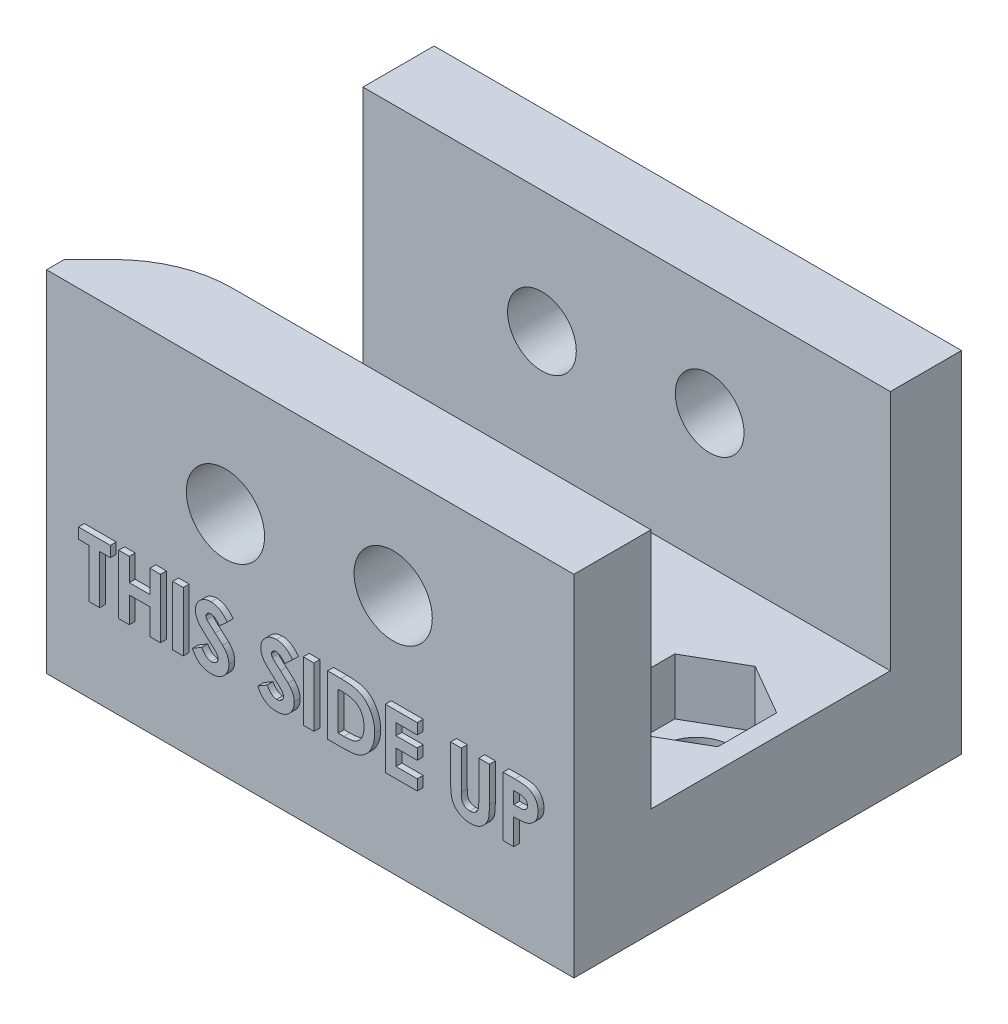
from build123d import *

# Parameters (mm, degrees)
SKETCH1_W                      = 44.5
SKETCH1_H                      = 20
BOSS_EXTRUDE1_DEPTH            = 6
SKETCH2_W                      = 44.5
SKETCH2_H                      = 9.5
BOSS_EXTRUDE2_DEPTH            = 6
SKETCH2_3_W                    = 44.5
SKETCH2_3_H                    = 9.1
BOSS_EXTRUDE3_DEPTH            = 20.2
BOSS_EXTRUDE4_DEPTH            = 6.5
SKETCH4_R                      = 2.9
CUT_EXTRUDE1_DEPTH             = 54.146989567
CUT_EXTRUDE2_DEPTH             = 4.75
SKETCH6_W                      = 18.5
SKETCH6_H                      = 30.7
CUT_EXTRUDE3_DEPTH             = 0.5
CHAMFER1_SIZE                  = 5
BOSS_EXTRUDE5_DEPTH            = 0.5
SKETCH11_W                     = 0.897435897
SKETCH11_H                     = 5
SKETCH11_W_2                   = 0.897435898
BOSS_EXTRUDE9_DEPTH            = 0.5
M5_CLEARANCE_HOLE1_D           = 5.8
M5_CLEARANCE_HOLE1_DEPTH       = 6
CUT_EXTRUDE4_REACH             = 50.658
SKETCH15_R                     = 3.3
CUT_EXTRUDE4_DIRECTION_2_DEPTH = 49.65750216
FILLET1_R                      = 10


with BuildPart() as part:
    # Sketch1 → Boss-Extrude1 (new body)
    with BuildSketch(Plane.XY):
        with Locations((7.5, 0)):
            Rectangle(SKETCH1_W, SKETCH1_H)
    extrude(amount=BOSS_EXTRUDE1_DEPTH)

    # Sketch2 → Boss-Extrude2 (add)
    with BuildSketch(Plane.XY.offset(6)):
        with Locations((7.5, -14.75)):
            Rectangle(SKETCH2_W, SKETCH2_H)
    extrude(amount=-BOSS_EXTRUDE2_DEPTH)

    # Sketch2<3> → Boss-Extrude3 (add)
    with BuildSketch(Plane.XY.offset(6)):
        with Locations((7.5, -14.95)):
            Rectangle(SKETCH2_3_W, SKETCH2_3_H)
    extrude(amount=BOSS_EXTRUDE3_DEPTH)

    # Sketch3 → Boss-Extrude4 (add)
    with BuildSketch(Plane.XY.offset(26.2)):
        Polygon((-14.75, 10), (-14.75, -10.4), (-14.75, -19.5), (29.75, -19.5), (29.75, -10.4), (29.75, 10), align=None)
    extrude(amount=BOSS_EXTRUDE4_DEPTH)

    # Sketch4 → Cut-Extrude1 (cut, through all)
    with BuildSketch(Plane.XZ.offset(19.5)):
        with Locations(Location((-8.725, 16.35, 0), (0, 0, 270))):
            Circle(SKETCH4_R)
        with Locations(Location((23.725, 16.35, 0), (0, 0, 90))):
            Circle(SKETCH4_R)
    extrude(amount=-CUT_EXTRUDE1_DEPTH, mode=Mode.SUBTRACT)

    # Sketch5 → Cut-Extrude2 (cut)
    with BuildSketch(Plane(origin=(0, -10.4, 0), x_dir=(1, 0, 0), z_dir=(0, 1, 0))):
        Polygon((-8.725, -11.384787685), (-13.025, -13.867393842), (-13.025, -18.832606158), (-8.725, -21.315212315), (-4.425, -18.832606158), (-4.425, -13.867393842), align=None)
        Polygon((23.725, -11.384787685), (19.425, -13.867393842), (19.425, -18.832606158), (23.725, -21.315212315), (28.025, -18.832606158), (28.025, -13.867393842), align=None)
    extrude(amount=-CUT_EXTRUDE2_DEPTH, mode=Mode.SUBTRACT)

    # Sketch6 → Cut-Extrude3 (cut)
    with BuildSketch(Plane.XZ.offset(19.5)):
        with Locations((7.5, 16.35)):
            Rectangle(SKETCH6_W, SKETCH6_H)
    extrude(amount=-CUT_EXTRUDE3_DEPTH, mode=Mode.SUBTRACT)

    # Chamfer1
    chamfer1_edges = [part.edges().sort_by_distance(p)[0] for p in [
        (-14.75, -0.2, 26.2),
    ]]
    chamfer(chamfer1_edges, length=CHAMFER1_SIZE)

    # Sketch8 → Boss-Extrude5 (add)
    # profile 1 of 8: a face of its own
    with BuildSketch(Plane(origin=(0, 0, 0), x_dir=(-1, 0, 0), z_dir=(0, 0, -1))):
        with BuildLine():
            Line((-22.928204882, -13.229726055), (-22.928204882, -7.729726055))
            Line((-22.928204882, -7.729726055), (-22.046794625, -7.729726055))
            add(Edge.make_bspline(
                [(-22.046794625, -7.729726055), (-21.985090396, -7.729719013), (-21.865693882, -7.729705387), (-21.693435873, -7.735754523), (-21.533681117, -7.743579758), (-21.386938015, -7.752334376), (-21.252956802, -7.767420332), (-21.131941217, -7.783319282), (-21.02364947, -7.802492435), (-20.956698568, -7.819691348), (-20.925200074, -7.827782946)],
                knots=[0, 0, 0, 0, 1.311965854, 2.538629056, 3.664479157, 4.713267157, 5.663616078, 6.530575999, 7.308677837, 8, 8, 8, 8], degree=3))
            add(Edge.make_bspline(
                [(-20.925200074, -7.827782946), (-20.883839354, -7.839196291), (-20.802676342, -7.861592936), (-20.686425009, -7.906823929), (-20.576144403, -7.957101385), (-20.471969175, -8.014458559), (-20.374539001, -8.079587913), (-20.284224149, -8.153006332), (-20.199076752, -8.231766805), (-20.122120199, -8.318064364), (-20.052564154, -8.409253721), (-19.992132423, -8.505310981), (-19.939624993, -8.604767367), (-19.897605296, -8.708874471), (-19.865944244, -8.817152851), (-19.842787483, -8.929140143), (-19.827778765, -9.045190701), (-19.826360639, -9.124143688), (-19.825640779, -9.164221248)],
                knots=[0, 0, 0, 0, 1.099996261, 2.158545794, 3.195537121, 4.207578794, 5.205712374, 6.197378256, 7.190519799, 8.17788031, 9.159561366, 10.129234751, 11.085776129, 12.040971148, 13.00380137, 13.975669004, 14.972423361, 16, 16, 16, 16], degree=3))
            add(Edge.make_bspline(
                [(-19.825640779, -9.164221248), (-19.827522998, -9.215710392), (-19.831227915, -9.317060446), (-19.854895176, -9.465925338), (-19.899274977, -9.606624059), (-19.957344868, -9.741749631), (-20.036301765, -9.870798037), (-20.136561753, -9.993707916), (-20.25650095, -10.114263848), (-20.348500935, -10.186528997), (-20.39635392, -10.224117081)],
                knots=[0, 0, 0, 0, 0.986156485, 1.941127874, 2.875419072, 3.804401753, 4.751181392, 5.761612777, 6.835722519, 8, 8, 8, 8], degree=3))
            add(Edge.make_bspline(
                [(-20.39635392, -10.224117081), (-20.357576157, -10.243912793), (-20.281543691, -10.282726707), (-20.173599926, -10.346525196), (-20.073655784, -10.41438298), (-19.981263143, -10.484934734), (-19.898360047, -10.561171248), (-19.821523285, -10.63869967), (-19.754543587, -10.721962055), (-19.694648322, -10.807990775), (-19.642588331, -10.898031535), (-19.597249819, -10.991932277), (-19.558954005, -11.090013785), (-19.526524119, -11.191776904), (-19.502337901, -11.297571652), (-19.486567973, -11.407435865), (-19.47449353, -11.520994851), (-19.473554252, -11.598348396), (-19.473076676, -11.63767878)],
                knots=[0, 0, 0, 0, 1.164658916, 2.283573913, 3.35186032, 4.395461096, 5.390182219, 6.362969632, 7.312859996, 8.245001507, 9.165155236, 10.092416118, 11.032087915, 11.979892451, 12.947605196, 13.931445124, 14.948243989, 16, 16, 16, 16], degree=3))
            add(Edge.make_bspline(
                [(-19.473076676, -11.63767878), (-19.476175823, -11.712797563), (-19.482291977, -11.861044181), (-19.52701031, -12.078704263), (-19.604537689, -12.285065763), (-19.708640974, -12.479308511), (-19.83691625, -12.6558095), (-19.984396032, -12.810422833), (-20.149595537, -12.941299587), (-20.302012047, -13.029631243), (-20.433840326, -13.088910044), (-20.543031226, -13.125559937), (-20.660299938, -13.159512343), (-20.787794544, -13.183354423), (-20.92320374, -13.205177317), (-21.067847773, -13.218651223), (-21.221456308, -13.227782158), (-21.32696129, -13.229064989), (-21.381329882, -13.229726055)],
                knots=[0, 0, 0, 0, 1.284142165, 2.534249414, 3.780121997, 5.041676246, 6.291546858, 7.49970053, 8.684500223, 9.883330709, 10.50184324, 11.153274765, 11.851151195, 12.587658647, 13.369265475, 14.195992086, 15.070362669, 16, 16, 16, 16], degree=3))
            Line((-21.381329882, -13.229726055), (-22.928204882, -13.229726055))
        make_face()
        with BuildLine():
            Line((-21.941025394, -8.716905543), (-21.941025394, -9.915623491))
            Line((-21.941025394, -9.915623491), (-21.678805843, -9.915623491))
            add(Edge.make_bspline(
                [(-21.678805843, -9.915623491), (-21.64316785, -9.915312715), (-21.574370862, -9.914712779), (-21.475000909, -9.906985814), (-21.382602901, -9.893803133), (-21.297527283, -9.875409977), (-21.218981544, -9.852053349), (-21.147467458, -9.823950297), (-21.08329946, -9.789661518), (-21.008751086, -9.738586869), (-20.92994808, -9.663428237), (-20.860578679, -9.55484602), (-20.819720566, -9.429976884), (-20.815170074, -9.3419095), (-20.812820266, -9.296432786)],
                knots=[0, 0, 0, 0, 1.065314748, 2.056525647, 2.977365736, 3.853934255, 4.656397591, 5.425096493, 6.14721249, 6.826394842, 8.123232004, 9.372140726, 10.643011755, 12, 12, 12, 12], degree=3))
            add(Edge.make_bspline(
                [(-20.812820266, -9.296432786), (-20.814700543, -9.253836288), (-20.818335981, -9.17147767), (-20.859474848, -9.055838835), (-20.923371642, -8.953359161), (-20.998810788, -8.883220205), (-21.069851403, -8.835317366), (-21.130680737, -8.803775386), (-21.197445499, -8.775539328), (-21.271438183, -8.75394935), (-21.35223625, -8.737748991), (-21.439447219, -8.725851767), (-21.533221559, -8.71775401), (-21.597991695, -8.717194432), (-21.631430042, -8.716905543)],
                knots=[0, 0, 0, 0, 1.347982417, 2.606269829, 3.849316587, 5.153353503, 5.842674298, 6.568177932, 7.326619318, 8.142485038, 9.012069166, 9.942760135, 10.937925643, 12, 12, 12, 12], degree=3))
            Line((-21.631430042, -8.716905543), (-21.941025394, -8.716905543))
        make_face(mode=Mode.SUBTRACT)
        with BuildLine():
            Line((-21.941025394, -10.832290158), (-21.941025394, -12.242546568))
            Line((-21.941025394, -12.242546568), (-21.656770587, -12.242546568))
            add(Edge.make_bspline(
                [(-21.656770587, -12.242546568), (-21.600573049, -12.242225514), (-21.492526271, -12.241608247), (-21.337749453, -12.234150191), (-21.197018631, -12.220708359), (-21.070706688, -12.203927314), (-20.958620155, -12.181191624), (-20.861137911, -12.152286108), (-20.776923112, -12.120485005), (-20.706480715, -12.081206867), (-20.648933312, -12.035496855), (-20.597002815, -11.988780125), (-20.554661923, -11.934887963), (-20.52116102, -11.87613381), (-20.492166047, -11.813977162), (-20.474678327, -11.745990825), (-20.46136379, -11.67418975), (-20.460631056, -11.624526499), (-20.460256164, -11.599117081)],
                knots=[0, 0, 0, 0, 1.753078804, 3.370512758, 4.83203934, 6.162291463, 7.344201807, 8.395507345, 9.331626367, 10.147333109, 10.898971645, 11.62040215, 12.321813352, 13.025280112, 13.727906689, 14.453419512, 15.208716525, 16, 16, 16, 16], degree=3))
            add(Edge.make_bspline(
                [(-20.460256164, -11.599117081), (-20.461082908, -11.570061012), (-20.462693184, -11.513467606), (-20.475844329, -11.430750304), (-20.499744254, -11.353528214), (-20.529847376, -11.279826664), (-20.571737469, -11.212284424), (-20.621522414, -11.148564116), (-20.681675336, -11.090823505), (-20.749320807, -11.035570222), (-20.828222551, -10.98719298), (-20.918417587, -10.945217154), (-21.020395904, -10.910160489), (-21.134473389, -10.88224835), (-21.260149937, -10.858559703), (-21.398342848, -10.844414966), (-21.547901204, -10.833894903), (-21.651607401, -10.832837228), (-21.705248151, -10.832290158)],
                knots=[0, 0, 0, 0, 0.845221588, 1.646264278, 2.427170338, 3.19324141, 3.95557735, 4.731569926, 5.540061037, 6.376114724, 7.268642756, 8.224665384, 9.265483498, 10.400594375, 11.639216012, 12.983232105, 14.439614077, 16, 16, 16, 16], degree=3))
            Line((-21.705248151, -10.832290158), (-21.941025394, -10.832290158))
        make_face(mode=Mode.SUBTRACT)
    # profile 2 of 8: a face of its own
    with BuildSketch(Plane(origin=(0, 0, 0), x_dir=(-1, 0, 0), z_dir=(0, 0, -1))):
        with BuildLine():
            add(Edge.make_bspline(
                [(-15.901161612, -7.588700414), (-15.805537372, -7.591176297), (-15.616753462, -7.596064251), (-15.339120457, -7.636809158), (-15.071569722, -7.703197143), (-14.814222243, -7.795481244), (-14.567722388, -7.916160983), (-14.331200671, -8.06181501), (-14.105504301, -8.235192459), (-13.892946033, -8.432248719), (-13.696503858, -8.646538798), (-13.526286598, -8.877260165), (-13.381131564, -9.118434598), (-13.260826683, -9.370708332), (-13.169192124, -9.635828482), (-13.104888363, -9.912443286), (-13.063576383, -10.200474049), (-13.05882487, -10.39658374), (-13.05641001, -10.496252498)],
                knots=[0, 0, 0, 0, 1.014329547, 2.002516266, 2.970391464, 3.935626869, 4.897733899, 5.877609409, 6.878433252, 7.912639331, 8.949961323, 9.958554974, 10.949718813, 11.932905612, 12.9188844, 13.919928257, 14.942845884, 16, 16, 16, 16], degree=3))
            add(Edge.make_bspline(
                [(-13.05641001, -10.496252498), (-13.058981731, -10.594798219), (-13.064049391, -10.788985724), (-13.103201827, -11.074362171), (-13.168588471, -11.348013854), (-13.258668836, -11.61056019), (-13.376791842, -11.860729495), (-13.519116195, -12.100119066), (-13.689397565, -12.326507309), (-13.881425122, -12.539772736), (-14.092830798, -12.733356872), (-14.316742969, -12.903952559), (-14.552127746, -13.048508906), (-14.798640603, -13.166959699), (-15.056810173, -13.258884997), (-15.325998747, -13.323744975), (-15.606189666, -13.363161693), (-15.79673308, -13.368196251), (-15.893449273, -13.370751696)],
                knots=[0, 0, 0, 0, 1.051557043, 2.072126891, 3.067553643, 4.050577992, 5.02905126, 6.015227836, 7.017913613, 8.04756643, 9.074058332, 10.072836633, 11.047628519, 12.017157415, 12.98668631, 13.966869689, 14.968021931, 16, 16, 16, 16], degree=3))
            add(Edge.make_bspline(
                [(-15.893449273, -13.370751696), (-15.994602814, -13.368459336), (-16.193355696, -13.363955161), (-16.484231428, -13.321122514), (-16.762915513, -13.256601584), (-17.027066845, -13.160307558), (-17.279375578, -13.039931928), (-17.517987927, -12.891682122), (-17.742823702, -12.715803136), (-17.952593208, -12.516799295), (-18.142644888, -12.299045444), (-18.310402775, -12.069007812), (-18.451910274, -11.828443682), (-18.567172562, -11.577240465), (-18.65804072, -11.31695933), (-18.722137881, -11.046015088), (-18.760001604, -10.765057561), (-18.765275801, -10.574225593), (-18.767948471, -10.47752253)],
                knots=[0, 0, 0, 0, 1.067978421, 2.098431617, 3.099715153, 4.085208694, 5.062210972, 6.048429807, 7.046490867, 8.072918869, 9.098532598, 10.095778865, 11.076610158, 12.041847152, 13.011192615, 13.984257998, 14.978533688, 16, 16, 16, 16], degree=3))
            add(Edge.make_bspline(
                [(-18.767948471, -10.47752253), (-18.767109633, -10.412465771), (-18.765442579, -10.283176022), (-18.745361153, -10.091575212), (-18.716449674, -9.903714194), (-18.673690968, -9.72034197), (-18.621750068, -9.540164936), (-18.554453296, -9.364860224), (-18.477851357, -9.192555097), (-18.388349204, -9.025284695), (-18.288831463, -8.864588045), (-18.180248748, -8.711223182), (-18.062328028, -8.56704451), (-17.935449166, -8.431104547), (-17.799174919, -8.304296837), (-17.655297834, -8.184826238), (-17.501027535, -8.075866316), (-17.339740512, -7.974756052), (-17.172346067, -7.883323794), (-16.999525645, -7.80549939), (-16.82483969, -7.737536664), (-16.645954632, -7.683897475), (-16.464787542, -7.640208917), (-16.279403019, -7.611316924), (-16.091475904, -7.591236055), (-15.964750261, -7.589547634), (-15.901161612, -7.588700414)],
                knots=[0, 0, 0, 0, 1.034744296, 2.056386356, 3.06226378, 4.057406941, 5.050368692, 6.043467995, 7.042652155, 8.049140477, 9.059438543, 10.048523776, 11.036952808, 12.020949711, 13.004946614, 13.997082645, 14.994316842, 16.007702937, 17.024872941, 18.026463647, 19.021641123, 20.005082605, 20.995858141, 21.984425357, 22.988620895, 24, 24, 24, 24], degree=3))
        make_face()
        with BuildLine():
            add(Edge.make_bspline(
                [(-15.916586292, -8.575879902), (-15.980941393, -8.577606693), (-16.10795261, -8.58101469), (-16.294254935, -8.606979011), (-16.473111747, -8.648446983), (-16.64353157, -8.708512834), (-16.806253021, -8.784961417), (-16.961564552, -8.877525612), (-17.107315421, -8.98938721), (-17.245449075, -9.11454086), (-17.370230101, -9.253990788), (-17.480478074, -9.403435102), (-17.57273787, -9.562624232), (-17.650006027, -9.730079349), (-17.708171824, -9.907683441), (-17.749601578, -10.094045317), (-17.775783635, -10.289486087), (-17.779083916, -10.422717805), (-17.780768984, -10.490743684)],
                knots=[0, 0, 0, 0, 1.033739768, 2.040188636, 3.016340934, 3.979330865, 4.937572243, 5.900995986, 6.878200029, 7.884839167, 8.891893314, 9.879764717, 10.863503415, 11.843163062, 12.837761627, 13.859916423, 14.907309254, 16, 16, 16, 16], degree=3))
            add(Edge.make_bspline(
                [(-17.780768984, -10.490743684), (-17.778534841, -10.566131659), (-17.774156291, -10.713879601), (-17.743348281, -10.929410317), (-17.690638842, -11.132957686), (-17.614527438, -11.32352619), (-17.520129328, -11.503231949), (-17.402901858, -11.669872412), (-17.264743557, -11.824445346), (-17.158307521, -11.914691464), (-17.104286612, -11.960495286)],
                knots=[0, 0, 0, 0, 1.078454662, 2.113592447, 3.107694534, 4.079536787, 5.043276885, 6.005368276, 6.987637804, 8, 8, 8, 8], degree=3))
            add(Edge.make_bspline(
                [(-17.104286612, -11.960495286), (-17.060033175, -11.994333391), (-16.972523337, -12.061247222), (-16.832838583, -12.147011025), (-16.688990792, -12.220519158), (-16.539894452, -12.279912861), (-16.385864446, -12.326630949), (-16.226921896, -12.359346858), (-16.063292012, -12.37987892), (-15.952637816, -12.38233289), (-15.896754561, -12.383572209)],
                knots=[0, 0, 0, 0, 1.023928204, 2.024787132, 3.009472467, 3.9914905, 4.972207045, 5.96565515, 6.972602802, 8, 8, 8, 8], degree=3))
            add(Edge.make_bspline(
                [(-15.896754561, -12.383572209), (-15.833506047, -12.381830776), (-15.709062607, -12.378404452), (-15.526228401, -12.352759766), (-15.351067678, -12.309359698), (-15.182493026, -12.249820766), (-15.020990538, -12.172412304), (-14.867349523, -12.076977058), (-14.721300604, -11.964686849), (-14.583342931, -11.837889658), (-14.457243096, -11.697890393), (-14.347225188, -11.547648959), (-14.252031991, -11.390475623), (-14.176370627, -11.224145835), (-14.11590683, -11.050229671), (-14.074975706, -10.867956893), (-14.048572469, -10.678078899), (-14.045271258, -10.548860214), (-14.043589497, -10.483031344)],
                knots=[0, 0, 0, 0, 1.026359118, 2.019393844, 2.989460624, 3.950973911, 4.916101784, 5.890408035, 6.881132271, 7.902007068, 8.92769091, 9.933912415, 10.920395702, 11.90457117, 12.894218921, 13.903490204, 14.931958862, 16, 16, 16, 16], degree=3))
            add(Edge.make_bspline(
                [(-14.043589497, -10.483031344), (-14.045329447, -10.417581008), (-14.048754274, -10.288752003), (-14.074444097, -10.099362184), (-14.117568933, -9.917894087), (-14.177286654, -9.744051355), (-14.253543021, -9.577663559), (-14.347841756, -9.419315815), (-14.459851974, -9.269161207), (-14.586995769, -9.128222983), (-14.725383976, -8.998709782), (-14.873957543, -8.886315867), (-15.028559216, -8.788649128), (-15.192736311, -8.712140948), (-15.363129902, -8.651187044), (-15.54077974, -8.606299715), (-15.726358685, -8.58119709), (-15.852611879, -8.577668096), (-15.916586292, -8.575879902)],
                knots=[0, 0, 0, 0, 1.055025985, 2.07665775, 3.074803781, 4.057872707, 5.035505728, 6.020516407, 7.023567878, 8.050795229, 9.077271434, 10.074415901, 11.050397877, 12.019801805, 12.988065821, 13.964604439, 14.968634123, 16, 16, 16, 16], degree=3))
        make_face(mode=Mode.SUBTRACT)
    # profile 3 of 8: a face of its own
    with BuildSketch(Plane(origin=(0, 0, 0), x_dir=(-1, 0, 0), z_dir=(0, 0, -1))):
        Polygon((-12.633333087, -7.729726055), (-9.671794625, -7.729726055), (-9.671794625, -8.716905543), (-10.658974112, -8.716905543), (-10.658974112, -13.229726055), (-11.6461536, -13.229726055), (-11.6461536, -8.716905543), (-12.633333087, -8.716905543), align=None)
    # profile 4 of 8: a face of its own
    with BuildSketch(Plane(origin=(0, 0, 0), x_dir=(-1, 0, 0), z_dir=(0, 0, -1))):
        with BuildLine():
            add(Edge.make_bspline(
                [(-8.508333087, -12.101520927), (-8.468481821, -12.103705876), (-8.390021562, -12.108007664), (-8.276657186, -12.140111454), (-8.174345184, -12.197790486), (-8.082864583, -12.273022787), (-8.005510891, -12.36353729), (-7.949601391, -12.466758014), (-7.914785144, -12.579685582), (-7.910941406, -12.658392686), (-7.908974112, -12.698676376)],
                knots=[0, 0, 0, 0, 1.016957001, 2.002212695, 2.9757545, 3.99499976, 5.013036768, 5.994806404, 6.97370641, 8, 8, 8, 8], degree=3))
            add(Edge.make_bspline(
                [(-7.908974112, -12.698676376), (-7.910928518, -12.738966535), (-7.914747076, -12.817686281), (-7.949842316, -12.930833896), (-8.005427344, -13.034903), (-8.082870789, -13.126387425), (-8.173966331, -13.203037549), (-8.276892419, -13.260184697), (-8.389805605, -13.294109653), (-8.46844381, -13.298176145), (-8.508333087, -13.300238876)],
                knots=[0, 0, 0, 0, 1.023218912, 1.999186227, 2.986238111, 4.008388923, 5.030539734, 6.0011649, 6.986089706, 8, 8, 8, 8], degree=3))
            add(Edge.make_bspline(
                [(-8.508333087, -13.300238876), (-8.548231815, -13.298192919), (-8.626888653, -13.294159494), (-8.739977355, -13.259898743), (-8.843663324, -13.203419085), (-8.934781753, -13.126294448), (-9.012571181, -13.035226954), (-9.066575875, -12.930505539), (-9.101998018, -12.817728939), (-9.105764374, -12.738980977), (-9.107692061, -12.698676376)],
                knots=[0, 0, 0, 0, 1.013427518, 1.99788335, 2.976245624, 3.997909735, 5.019573847, 6.001765691, 6.977268297, 8, 8, 8, 8], degree=3))
            add(Edge.make_bspline(
                [(-9.107692061, -12.698676376), (-9.105751656, -12.658377993), (-9.101960452, -12.579642181), (-9.066816114, -12.467090153), (-9.012484629, -12.363211576), (-8.934788241, -12.273115957), (-8.843282519, -12.197411928), (-8.740213908, -12.14039349), (-8.626672805, -12.107957455), (-8.548193849, -12.103688964), (-8.508333087, -12.101520927)],
                knots=[0, 0, 0, 0, 1.025808215, 2.00424526, 2.981110158, 3.998665696, 5.017428914, 5.998734231, 6.983523959, 8, 8, 8, 8], degree=3))
        make_face()
    # profile 5 of 8: a face of its own
    with BuildSketch(Plane(origin=(0, 0, 0), x_dir=(-1, 0, 0), z_dir=(0, 0, -1))):
        Polygon((-4.665384369, -7.729726055), (-3.678204882, -7.729726055), (-3.678204882, -12.242546568), (-2.12692283, -12.242546568), (-2.12692283, -13.229726055), (-4.665384369, -13.229726055), align=None)
    # profile 6 of 8: a face of its own
    with BuildSketch(Plane(origin=(0, 0, 0), x_dir=(-1, 0, 0), z_dir=(0, 0, -1))):
        Polygon((-1.280768984, -7.729726055), (1.680769477, -7.729726055), (1.680769477, -8.716905543), (-0.293589497, -8.716905543), (-0.293589497, -9.77459785), (1.680769477, -9.77459785), (1.680769477, -10.761777337), (-0.293589497, -10.761777337), (-0.293589497, -12.242546568), (1.680769477, -12.242546568), (1.680769477, -13.229726055), (-1.280768984, -13.229726055), align=None)
    # profile 7 of 8: a face of its own
    with BuildSketch(Plane(origin=(0, 0, 0), x_dir=(-1, 0, 0), z_dir=(0, 0, -1))):
        Polygon((2.667948965, -7.729726055), (5.347436144, -7.729726055), (5.347436144, -8.716905543), (3.655128452, -8.716905543), (3.655128452, -9.77459785), (5.347436144, -9.77459785), (5.347436144, -10.761777337), (3.655128452, -10.761777337), (3.655128452, -13.229726055), (2.667948965, -13.229726055), align=None)
    # profile 8 of 8: a face of its own
    with BuildSketch(Plane(origin=(0, 0, 0), x_dir=(-1, 0, 0), z_dir=(0, 0, -1))):
        Polygon((5.770513067, -7.729726055), (8.732051529, -7.729726055), (8.732051529, -8.716905543), (7.744872042, -8.716905543), (7.744872042, -13.229726055), (6.757692554, -13.229726055), (6.757692554, -8.716905543), (5.770513067, -8.716905543), align=None)
    extrude(amount=BOSS_EXTRUDE5_DEPTH)

    # Sketch11 → Boss-Extrude9 (add)
    # profile 1 of 10: a face of its own
    with BuildSketch(Plane.XY.offset(32.7)):
        Polygon((-11.558498055, -6.94713032), (-8.866190363, -6.94713032), (-8.866190363, -7.844566218), (-9.76362626, -7.844566218), (-9.76362626, -11.94713032), (-10.661062158, -11.94713032), (-10.661062158, -7.844566218), (-11.558498055, -7.844566218), align=None)
    # profile 2 of 10: a face of its own
    with BuildSketch(Plane.XY.offset(32.7)):
        Polygon((-8.161062158, -6.94713032), (-7.26362626, -6.94713032), (-7.26362626, -8.870207243), (-5.532857029, -8.870207243), (-5.532857029, -6.94713032), (-4.635421132, -6.94713032), (-4.635421132, -11.94713032), (-5.532857029, -11.94713032), (-5.532857029, -9.767643141), (-7.26362626, -9.767643141), (-7.26362626, -11.94713032), (-8.161062158, -11.94713032), align=None)
    # profile 3 of 10: a face of its own
    with BuildSketch(Plane.XY.offset(32.7)):
        with Locations((-3.161062157, -9.44713032)):
            Rectangle(SKETCH11_W, SKETCH11_H)
    # profile 4 of 10: a face of its own
    with BuildSketch(Plane.XY.offset(32.7)):
        with BuildLine():
            Line((1.005604509, -7.61519923), (0.334530791, -8.229181602))
            add(Edge.make_bspline(
                [(0.334530791, -8.229181602), (0.30578487, -8.188632493), (0.250596712, -8.110783857), (0.161142463, -8.0065427), (0.072092145, -7.917617235), (-0.017379237, -7.844378952), (-0.108064725, -7.787272828), (-0.199806902, -7.746841062), (-0.292085655, -7.721138204), (-0.354082733, -7.71793758), (-0.38461985, -7.716361089)],
                knots=[0, 0, 0, 0, 1.299362458, 2.494594718, 3.587462134, 4.587049575, 5.512617175, 6.380583204, 7.202344345, 8, 8, 8, 8], degree=3))
            add(Edge.make_bspline(
                [(-0.38461985, -7.716361089), (-0.413103997, -7.717360026), (-0.4680994, -7.719288711), (-0.546499427, -7.738459695), (-0.616104088, -7.771545999), (-0.676845451, -7.814809124), (-0.724961573, -7.866931159), (-0.763378564, -7.921593773), (-0.785010559, -7.981928937), (-0.787857755, -8.023369561), (-0.789267286, -8.043885128)],
                knots=[0, 0, 0, 0, 1.185010067, 2.2879431, 3.333075148, 4.379039566, 5.372662701, 6.27520591, 7.14612461, 8, 8, 8, 8], degree=3))
            add(Edge.make_bspline(
                [(-0.789267286, -8.043885128), (-0.788384004, -8.064696539), (-0.786605198, -8.106607828), (-0.769424349, -8.168034042), (-0.743527905, -8.228054603), (-0.718782795, -8.264591975), (-0.706134273, -8.283268141)],
                knots=[0, 0, 0, 0, 0.967525499, 1.948461899, 2.951351359, 4, 4, 4, 4], degree=3))
            add(Edge.make_bspline(
                [(-0.706134273, -8.283268141), (-0.694635398, -8.297784929), (-0.668166506, -8.331200658), (-0.61769575, -8.384125964), (-0.55431508, -8.448964096), (-0.475585475, -8.523485462), (-0.384775217, -8.61037014), (-0.277675133, -8.706202661), (-0.157368031, -8.813950848), (-0.071856531, -8.888982783), (-0.027047735, -8.928300192)],
                knots=[0, 0, 0, 0, 0.473873513, 1.090794244, 1.870441696, 2.795289791, 3.865433203, 5.087734844, 6.473946851, 8, 8, 8, 8], degree=3))
            add(Edge.make_bspline(
                [(-0.027047735, -8.928300192), (0.015011766, -8.964700568), (0.09483196, -9.03378092), (0.208400246, -9.131829388), (0.308207854, -9.220041204), (0.395708754, -9.297092497), (0.469576518, -9.363791712), (0.530121686, -9.42045767), (0.578083714, -9.46598719), (0.605347319, -9.493487047), (0.616982714, -9.505223269)],
                knots=[0, 0, 0, 0, 1.543621617, 2.929473131, 4.163658386, 5.240097082, 6.164993805, 6.925417477, 7.541396219, 8, 8, 8, 8], degree=3))
            add(Edge.make_bspline(
                [(0.616982714, -9.505223269), (0.661124978, -9.552994652), (0.74598191, -9.644828027), (0.856266009, -9.787140876), (0.947033389, -9.926067236), (1.017252755, -10.06422123), (1.070285245, -10.203596146), (1.107673853, -10.347610146), (1.130066139, -10.497768086), (1.132552206, -10.60023255), (1.133809637, -10.652058205)],
                knots=[0, 0, 0, 0, 1.206664779, 2.319633467, 3.337109185, 4.282041471, 5.190008762, 6.099243693, 7.03861361, 8, 8, 8, 8], degree=3))
            add(Edge.make_bspline(
                [(1.133809637, -10.652058205), (1.13291463, -10.70255595), (1.131158592, -10.801634405), (1.109650495, -10.946620965), (1.078981212, -11.085379396), (1.031561119, -11.216399809), (0.973765791, -11.341832865), (0.901311, -11.459724716), (0.816222784, -11.571268475), (0.718698622, -11.67447016), (0.61082532, -11.768118537), (0.49512095, -11.851486534), (0.370454099, -11.920317435), (0.237889899, -11.976994772), (0.09749931, -12.020648414), (-0.050550421, -12.052912525), (-0.206485747, -12.072276935), (-0.313116569, -12.074301255), (-0.367592606, -12.075335448)],
                knots=[0, 0, 0, 0, 1.043214005, 2.046824704, 3.02475056, 3.976699089, 4.921714032, 5.875962561, 6.831408892, 7.817874052, 8.806269674, 9.781291748, 10.760897367, 11.74438705, 12.757449933, 13.795994037, 14.874007457, 16, 16, 16, 16], degree=3))
            add(Edge.make_bspline(
                [(-0.367592606, -12.075335448), (-0.410355832, -12.0745768), (-0.495051543, -12.073074242), (-0.619880216, -12.060807104), (-0.740416412, -12.041009248), (-0.856524356, -12.012633006), (-0.968727135, -11.97667646), (-1.077029358, -11.932756916), (-1.180683378, -11.880193637), (-1.280473491, -11.820067535), (-1.375914593, -11.75025321), (-1.4682135, -11.672177993), (-1.556453411, -11.584641053), (-1.641058126, -11.487849412), (-1.721486318, -11.381528978), (-1.800370692, -11.26716046), (-1.874205389, -11.142621334), (-1.919816365, -11.05525613), (-1.94311344, -11.010631923)],
                knots=[0, 0, 0, 0, 1.016823716, 2.013894106, 2.979844003, 3.91962641, 4.853723003, 5.779685073, 6.695824784, 7.614987388, 8.547259901, 9.504950863, 10.487499108, 11.500346958, 12.559593716, 13.656357062, 14.802919212, 16, 16, 16, 16], degree=3))
            Line((-1.94311344, -11.010631923), (-1.153850619, -10.53687391))
            add(Edge.make_bspline(
                [(-1.153850619, -10.53687391), (-1.124709461, -10.587528215), (-1.068843371, -10.684636848), (-0.974173057, -10.815114604), (-0.877188155, -10.926847203), (-0.775646458, -11.017859766), (-0.670782677, -11.089369247), (-0.562090295, -11.140474884), (-0.449492946, -11.172109215), (-0.372796748, -11.175972497), (-0.334539722, -11.177899551)],
                knots=[0, 0, 0, 0, 1.283663364, 2.460892379, 3.537111102, 4.529833553, 5.449777664, 6.316464042, 7.160231139, 8, 8, 8, 8], degree=3))
            add(Edge.make_bspline(
                [(-0.334539722, -11.177899551), (-0.295626849, -11.176325814), (-0.220130208, -11.173272536), (-0.112368415, -11.145070326), (-0.013568323, -11.100790787), (0.071833748, -11.037609991), (0.144146836, -10.96468975), (0.197518046, -10.883562647), (0.231046201, -10.79578508), (0.234590939, -10.734809008), (0.23637374, -10.704141538)],
                knots=[0, 0, 0, 0, 1.13588714, 2.203786484, 3.234766741, 4.283437687, 5.291419208, 6.222934724, 7.106237994, 8, 8, 8, 8], degree=3))
            add(Edge.make_bspline(
                [(0.23637374, -10.704141538), (0.234727397, -10.675610448), (0.231383008, -10.617652269), (0.206749271, -10.531477777), (0.168239226, -10.445342475), (0.122679128, -10.37469197), (0.076316023, -10.315538218), (0.031982438, -10.264284167), (-0.022004141, -10.207657414), (-0.085506829, -10.145586726), (-0.157686587, -10.07752568), (-0.23860422, -10.00348094), (-0.329186319, -9.924104752), (-0.393209925, -9.870034477), (-0.426687158, -9.84176173)],
                knots=[0, 0, 0, 0, 0.916159276, 1.861089862, 2.860218735, 3.940849679, 4.552606315, 5.27541173, 6.11797699, 7.06649574, 8.129236253, 9.306560635, 10.591630461, 12, 12, 12, 12], degree=3))
            add(Edge.make_bspline(
                [(-0.426687158, -9.84176173), (-0.49032871, -9.787914875), (-0.612476111, -9.68456646), (-0.785085886, -9.531924106), (-0.940622748, -9.389265839), (-1.077743315, -9.254828092), (-1.198194714, -9.131093618), (-1.301161196, -9.017057399), (-1.385511627, -8.911839801), (-1.474272268, -8.787216597), (-1.558612624, -8.63535466), (-1.631506625, -8.452647145), (-1.678797176, -8.269962813), (-1.684095424, -8.147318615), (-1.686703183, -8.086954038)],
                knots=[0, 0, 0, 0, 1.345494975, 2.582412109, 3.71882943, 4.751509156, 5.681369928, 6.505683931, 7.230279997, 7.856715994, 8.973648664, 10.023341002, 11.027102913, 12, 12, 12, 12], degree=3))
            add(Edge.make_bspline(
                [(-1.686703183, -8.086954038), (-1.68561862, -8.04414672), (-1.683481913, -7.959811706), (-1.66442216, -7.835809356), (-1.635936632, -7.716157507), (-1.594567468, -7.601292704), (-1.540875289, -7.491358819), (-1.475668222, -7.38581768), (-1.397933727, -7.285640665), (-1.310332198, -7.190894182), (-1.213817742, -7.104306679), (-1.11067978, -7.027884531), (-1.001502083, -6.963337274), (-0.886952544, -6.909790637), (-0.766321348, -6.868804088), (-0.640497179, -6.83975078), (-0.509299565, -6.822470798), (-0.42006178, -6.820121785), (-0.374603824, -6.818925192)],
                knots=[0, 0, 0, 0, 1.010766082, 1.991317756, 2.957454644, 3.913069143, 4.869106762, 5.843196583, 6.838735724, 7.860187025, 8.887984031, 9.89767229, 10.887916223, 11.879572884, 12.879850636, 13.892031539, 14.926195476, 16, 16, 16, 16], degree=3))
            add(Edge.make_bspline(
                [(-0.374603824, -6.818925192), (-0.315692563, -6.821080291), (-0.198335067, -6.825373479), (-0.024818623, -6.8589448), (0.144664985, -6.91173924), (0.281238053, -6.975429922), (0.389906693, -7.037127117), (0.473191055, -7.093930122), (0.557937376, -7.159001017), (0.644829083, -7.232544857), (0.732251593, -7.315947306), (0.822690747, -7.407222903), (0.9149142, -7.507160481), (0.974844821, -7.578555424), (1.005604509, -7.61519923)],
                knots=[0, 0, 0, 0, 1.282922637, 2.555718331, 3.837320111, 5.142675274, 5.830281639, 6.55870424, 7.337177975, 8.157850921, 9.037902056, 9.96903443, 10.957596896, 12, 12, 12, 12], degree=3))
        make_face()
    # profile 5 of 10: a face of its own
    with BuildSketch(Plane.XY.offset(32.7)):
        with BuildLine():
            Line((6.518425022, -7.61519923), (5.847351304, -8.229181602))
            add(Edge.make_bspline(
                [(5.847351304, -8.229181602), (5.818605383, -8.188632493), (5.763417225, -8.110783857), (5.673962975, -8.0065427), (5.584912658, -7.917617235), (5.495441276, -7.844378952), (5.404755788, -7.787272828), (5.313013611, -7.746841062), (5.220734857, -7.721138204), (5.15873778, -7.71793758), (5.128200663, -7.716361089)],
                knots=[0, 0, 0, 0, 1.299362458, 2.494594718, 3.587462134, 4.587049575, 5.512617175, 6.380583204, 7.202344345, 8, 8, 8, 8], degree=3))
            add(Edge.make_bspline(
                [(5.128200663, -7.716361089), (5.099716516, -7.717360026), (5.044721113, -7.719288711), (4.966321086, -7.738459695), (4.896716425, -7.771545999), (4.835975061, -7.814809124), (4.78785894, -7.866931159), (4.749441948, -7.921593773), (4.727809954, -7.981928937), (4.724962758, -8.023369561), (4.723553227, -8.043885128)],
                knots=[0, 0, 0, 0, 1.185010067, 2.2879431, 3.333075148, 4.379039566, 5.372662701, 6.27520591, 7.14612461, 8, 8, 8, 8], degree=3))
            add(Edge.make_bspline(
                [(4.723553227, -8.043885128), (4.724436509, -8.064696539), (4.726215315, -8.106607828), (4.743396163, -8.168034042), (4.769292608, -8.228054603), (4.794037717, -8.264591975), (4.80668624, -8.283268141)],
                knots=[0, 0, 0, 0, 0.967525499, 1.948461899, 2.951351359, 4, 4, 4, 4], degree=3))
            add(Edge.make_bspline(
                [(4.80668624, -8.283268141), (4.818185115, -8.297784929), (4.844654007, -8.331200658), (4.895124763, -8.384125964), (4.958505433, -8.448964096), (5.037235038, -8.523485462), (5.128045296, -8.61037014), (5.235145379, -8.706202661), (5.355452481, -8.813950848), (5.440963982, -8.888982783), (5.485772778, -8.928300192)],
                knots=[0, 0, 0, 0, 0.473873513, 1.090794244, 1.870441696, 2.795289791, 3.865433203, 5.087734844, 6.473946851, 8, 8, 8, 8], degree=3))
            add(Edge.make_bspline(
                [(5.485772778, -8.928300192), (5.527832279, -8.964700568), (5.607652473, -9.03378092), (5.721220758, -9.131829388), (5.821028367, -9.220041204), (5.908529267, -9.297092497), (5.982397031, -9.363791712), (6.042942198, -9.42045767), (6.090904227, -9.46598719), (6.118167832, -9.493487047), (6.129803227, -9.505223269)],
                knots=[0, 0, 0, 0, 1.543621617, 2.929473131, 4.163658386, 5.240097082, 6.164993805, 6.925417477, 7.541396219, 8, 8, 8, 8], degree=3))
            add(Edge.make_bspline(
                [(6.129803227, -9.505223269), (6.17394549, -9.552994652), (6.258802423, -9.644828027), (6.369086521, -9.787140876), (6.459853902, -9.926067236), (6.530073268, -10.06422123), (6.583105758, -10.203596146), (6.620494366, -10.347610146), (6.642886652, -10.497768086), (6.645372719, -10.60023255), (6.64663015, -10.652058205)],
                knots=[0, 0, 0, 0, 1.206664779, 2.319633467, 3.337109185, 4.282041471, 5.190008762, 6.099243693, 7.03861361, 8, 8, 8, 8], degree=3))
            add(Edge.make_bspline(
                [(6.64663015, -10.652058205), (6.645735143, -10.70255595), (6.643979105, -10.801634405), (6.622471008, -10.946620965), (6.591801725, -11.085379396), (6.544381632, -11.216399809), (6.486586304, -11.341832865), (6.414131513, -11.459724716), (6.329043296, -11.571268475), (6.231519135, -11.67447016), (6.123645832, -11.768118537), (6.007941463, -11.851486534), (5.883274612, -11.920317435), (5.750710412, -11.976994772), (5.610319823, -12.020648414), (5.462270092, -12.052912525), (5.306334766, -12.072276935), (5.199703944, -12.074301255), (5.145227906, -12.075335448)],
                knots=[0, 0, 0, 0, 1.043214005, 2.046824704, 3.02475056, 3.976699089, 4.921714032, 5.875962561, 6.831408892, 7.817874052, 8.806269674, 9.781291748, 10.760897367, 11.74438705, 12.757449933, 13.795994037, 14.874007457, 16, 16, 16, 16], degree=3))
            add(Edge.make_bspline(
                [(5.145227906, -12.075335448), (5.102464681, -12.0745768), (5.01776897, -12.073074242), (4.892940297, -12.060807104), (4.772404101, -12.041009248), (4.656296157, -12.012633006), (4.544093378, -11.97667646), (4.435791155, -11.932756916), (4.332137135, -11.880193637), (4.232347022, -11.820067535), (4.13690592, -11.75025321), (4.044607013, -11.672177993), (3.956367101, -11.584641053), (3.871762387, -11.487849412), (3.791334195, -11.381528978), (3.712449821, -11.26716046), (3.638615124, -11.142621334), (3.593004147, -11.05525613), (3.569707073, -11.010631923)],
                knots=[0, 0, 0, 0, 1.016823716, 2.013894106, 2.979844003, 3.91962641, 4.853723003, 5.779685073, 6.695824784, 7.614987388, 8.547259901, 9.504950863, 10.487499108, 11.500346958, 12.559593716, 13.656357062, 14.802919212, 16, 16, 16, 16], degree=3))
            Line((3.569707073, -11.010631923), (4.358969894, -10.53687391))
            add(Edge.make_bspline(
                [(4.358969894, -10.53687391), (4.388111052, -10.587528215), (4.443977142, -10.684636848), (4.538647455, -10.815114604), (4.635632358, -10.926847203), (4.737174055, -11.017859766), (4.842037836, -11.089369247), (4.950730218, -11.140474884), (5.063327566, -11.172109215), (5.140023765, -11.175972497), (5.178280791, -11.177899551)],
                knots=[0, 0, 0, 0, 1.283663364, 2.460892379, 3.537111102, 4.529833553, 5.449777664, 6.316464042, 7.160231139, 8, 8, 8, 8], degree=3))
            add(Edge.make_bspline(
                [(5.178280791, -11.177899551), (5.217193664, -11.176325814), (5.292690304, -11.173272536), (5.400452098, -11.145070326), (5.49925219, -11.100790787), (5.584654261, -11.037609991), (5.656967349, -10.96468975), (5.710338559, -10.883562647), (5.743866713, -10.79578508), (5.747411452, -10.734809008), (5.749194253, -10.704141538)],
                knots=[0, 0, 0, 0, 1.13588714, 2.203786484, 3.234766741, 4.283437687, 5.291419208, 6.222934724, 7.106237994, 8, 8, 8, 8], degree=3))
            add(Edge.make_bspline(
                [(5.749194253, -10.704141538), (5.747547909, -10.675610448), (5.744203521, -10.617652269), (5.719569784, -10.531477777), (5.681059739, -10.445342475), (5.635499641, -10.37469197), (5.589136536, -10.315538218), (5.544802951, -10.264284167), (5.490816371, -10.207657414), (5.427313684, -10.145586726), (5.355133925, -10.07752568), (5.274216293, -10.00348094), (5.183634194, -9.924104752), (5.119610588, -9.870034477), (5.086133355, -9.84176173)],
                knots=[0, 0, 0, 0, 0.916159276, 1.861089862, 2.860218735, 3.940849679, 4.552606315, 5.27541173, 6.11797699, 7.06649574, 8.129236253, 9.306560635, 10.591630461, 12, 12, 12, 12], degree=3))
            add(Edge.make_bspline(
                [(5.086133355, -9.84176173), (5.022491803, -9.787914875), (4.900344402, -9.68456646), (4.727734627, -9.531924106), (4.572197765, -9.389265839), (4.435077198, -9.254828092), (4.314625799, -9.131093618), (4.211659317, -9.017057399), (4.127308885, -8.911839801), (4.038548245, -8.787216597), (3.954207889, -8.63535466), (3.881313888, -8.452647145), (3.834023337, -8.269962813), (3.828725089, -8.147318615), (3.82611733, -8.086954038)],
                knots=[0, 0, 0, 0, 1.345494975, 2.582412109, 3.71882943, 4.751509156, 5.681369928, 6.505683931, 7.230279997, 7.856715994, 8.973648664, 10.023341002, 11.027102913, 12, 12, 12, 12], degree=3))
            add(Edge.make_bspline(
                [(3.82611733, -8.086954038), (3.827201893, -8.04414672), (3.8293386, -7.959811706), (3.848398353, -7.835809356), (3.876883881, -7.716157507), (3.918253044, -7.601292704), (3.971945224, -7.491358819), (4.03715229, -7.38581768), (4.114886786, -7.285640665), (4.202488315, -7.190894182), (4.299002771, -7.104306679), (4.402140733, -7.027884531), (4.51131843, -6.963337274), (4.625867968, -6.909790637), (4.746499165, -6.868804088), (4.872323334, -6.83975078), (5.003520948, -6.822470798), (5.092758733, -6.820121785), (5.138216688, -6.818925192)],
                knots=[0, 0, 0, 0, 1.010766082, 1.991317756, 2.957454644, 3.913069143, 4.869106762, 5.843196583, 6.838735724, 7.860187025, 8.887984031, 9.89767229, 10.887916223, 11.879572884, 12.879850636, 13.892031539, 14.926195476, 16, 16, 16, 16], degree=3))
            add(Edge.make_bspline(
                [(5.138216688, -6.818925192), (5.197127949, -6.821080291), (5.314485446, -6.825373479), (5.48800189, -6.8589448), (5.657485498, -6.91173924), (5.794058566, -6.975429922), (5.902727206, -7.037127117), (5.986011568, -7.093930122), (6.070757889, -7.159001017), (6.157649596, -7.232544857), (6.245072106, -7.315947306), (6.33551126, -7.407222903), (6.427734712, -7.507160481), (6.487665334, -7.578555424), (6.518425022, -7.61519923)],
                knots=[0, 0, 0, 0, 1.282922637, 2.555718331, 3.837320111, 5.142675274, 5.830281639, 6.55870424, 7.337177975, 8.157850921, 9.037902056, 9.96903443, 10.957596896, 12, 12, 12, 12], degree=3))
        make_face()
    # profile 6 of 10: a face of its own
    with BuildSketch(Plane.XY.offset(32.7)):
        with Locations((7.864578868, -9.44713032)):
            Rectangle(SKETCH11_W_2, SKETCH11_H)
    # profile 7 of 10: a face of its own
    with BuildSketch(Plane.XY.offset(32.7)):
        with BuildLine():
            Line((9.467142971, -6.94713032), (10.597952265, -6.94713032))
            add(Edge.make_bspline(
                [(10.597952265, -6.94713032), (10.686111857, -6.947746586), (10.856525343, -6.948937834), (11.103420771, -6.962360341), (11.333002102, -6.983003204), (11.545417327, -7.011401202), (11.740230961, -7.048979531), (11.917191796, -7.096114179), (12.076893755, -7.150523289), (12.221087936, -7.214546648), (12.352723355, -7.289191526), (12.477715386, -7.372339927), (12.595818611, -7.46703782), (12.708690422, -7.571458294), (12.814874183, -7.68751169), (12.916138236, -7.813275743), (13.010003175, -7.950574205), (13.099306337, -8.096115092), (13.180069163, -8.250515193), (13.250513518, -8.412460286), (13.309525181, -8.580908193), (13.357475213, -8.756038437), (13.395696923, -8.937269639), (13.422439883, -9.124967505), (13.438972647, -9.31895826), (13.440649758, -9.45043532), (13.441501945, -9.5172425)],
                knots=[0, 0, 0, 0, 1.44355588, 2.790409838, 4.047694926, 5.217575253, 6.298404546, 7.294384826, 8.214239204, 9.058592145, 9.873746385, 10.689560431, 11.514393297, 12.350027578, 13.205127629, 14.088021785, 14.991911688, 15.926770944, 16.882954281, 17.842803888, 18.816321264, 19.80318086, 20.814351908, 21.847355356, 22.906180909, 24, 24, 24, 24], degree=3))
            add(Edge.make_bspline(
                [(13.441501945, -9.5172425), (13.439270459, -9.611511779), (13.43487765, -9.797086373), (13.397875073, -10.069414952), (13.338029378, -10.330469057), (13.253880895, -10.578206621), (13.149559302, -10.810421505), (13.024935477, -11.023018696), (12.881836696, -11.214857081), (12.721930068, -11.384981461), (12.548790136, -11.531205672), (12.368862832, -11.656436007), (12.180395336, -11.755190576), (12.014329134, -11.817815741), (11.870329019, -11.856763175), (11.743898476, -11.879781484), (11.600286279, -11.900890661), (11.438153369, -11.91720338), (11.258210988, -11.931750315), (11.059741884, -11.939654554), (10.843388643, -11.946221803), (10.69311086, -11.946819546), (10.614979509, -11.94713032)],
                knots=[0, 0, 0, 0, 1.315458931, 2.589557908, 3.828601765, 5.048913369, 6.235739168, 7.376350998, 8.481830359, 9.569842114, 10.627874879, 11.640079404, 12.624025415, 13.590060155, 14.111227486, 14.704434459, 15.382649715, 16.137166398, 16.978595427, 17.902333227, 18.909396075, 20, 20, 20, 20], degree=3))
            Line((10.614979509, -11.94713032), (9.467142971, -11.94713032))
            Line((9.467142971, -11.94713032), (9.467142971, -6.94713032))
        make_face()
        with BuildLine():
            Line((10.364578868, -7.844566218), (10.364578868, -11.049694423))
            Line((10.364578868, -11.049694423), (10.833328868, -11.049694423))
            add(Edge.make_bspline(
                [(10.833328868, -11.049694423), (10.889102919, -11.049592221), (10.996374987, -11.049395655), (11.15125157, -11.040033006), (11.29447314, -11.030635489), (11.42564544, -11.012798688), (11.545723102, -10.992929746), (11.653056573, -10.965279393), (11.749858463, -10.93623504), (11.834946354, -10.899257978), (11.91287993, -10.857637834), (11.98503752, -10.80887501), (12.054689796, -10.754725734), (12.120534554, -10.693597397), (12.182821, -10.626299454), (12.241180607, -10.552485148), (12.296392323, -10.472379689), (12.347038968, -10.38555954), (12.393320142, -10.29294154), (12.43437673, -10.195422831), (12.4684187, -10.092191291), (12.496712301, -9.984213292), (12.516931287, -9.870548763), (12.533658642, -9.752039602), (12.542282081, -9.628216284), (12.543465594, -9.54396276), (12.544066047, -9.501216859)],
                knots=[0, 0, 0, 0, 1.50275155, 2.890291501, 4.180787663, 5.369391935, 6.45668281, 7.458360028, 8.354766181, 9.177074746, 9.954075863, 10.732690366, 11.5210699, 12.329727389, 13.151100085, 13.990027547, 14.863562427, 15.770965086, 16.696477834, 17.652329173, 18.619756807, 19.62365428, 20.657822005, 21.729286259, 22.847956731, 24, 24, 24, 24], degree=3))
            add(Edge.make_bspline(
                [(12.544066047, -9.501216859), (12.542870148, -9.435712806), (12.540538235, -9.307984979), (12.51804978, -9.121946611), (12.481442863, -8.946763618), (12.429208321, -8.78308615), (12.363365061, -8.630454189), (12.280946873, -8.49016085), (12.185500718, -8.359849398), (12.110024503, -8.28340452), (12.07231124, -8.245207243)],
                knots=[0, 0, 0, 0, 1.13821349, 2.219428113, 3.251817212, 4.244760574, 5.201143372, 6.134805572, 7.068016741, 8, 8, 8, 8], degree=3))
            add(Edge.make_bspline(
                [(12.07231124, -8.245207243), (12.035122391, -8.212658), (11.959168378, -8.146179856), (11.825818092, -8.066522039), (11.678872982, -7.996534838), (11.514971386, -7.941042794), (11.33569734, -7.897157319), (11.139983084, -7.866890581), (10.92887671, -7.847441495), (10.782627133, -7.845545177), (10.707126945, -7.844566218)],
                knots=[0, 0, 0, 0, 0.813307809, 1.661089106, 2.549956539, 3.493439533, 4.508053171, 5.589449661, 6.755572447, 8, 8, 8, 8], degree=3))
            Line((10.707126945, -7.844566218), (10.364578868, -7.844566218))
        make_face(mode=Mode.SUBTRACT)
    # profile 8 of 10: a face of its own
    with BuildSketch(Plane.XY.offset(32.7)):
        Polygon((14.338937842, -6.94713032), (17.031245535, -6.94713032), (17.031245535, -7.844566218), (15.23637374, -7.844566218), (15.23637374, -8.806104679), (17.031245535, -8.806104679), (17.031245535, -9.703540576), (15.23637374, -9.703540576), (15.23637374, -11.049694423), (17.031245535, -11.049694423), (17.031245535, -11.94713032), (14.338937842, -11.94713032), align=None)
    # profile 9 of 10: a face of its own
    with BuildSketch(Plane.XY.offset(32.7)):
        with BuildLine():
            Line((19.851758355, -6.94713032), (20.749194253, -6.94713032))
            Line((20.749194253, -6.94713032), (20.749194253, -10.200335448))
            add(Edge.make_bspline(
                [(20.749194253, -10.200335448), (20.749243051, -10.234063268), (20.749337304, -10.299208203), (20.754055663, -10.392669857), (20.758373287, -10.478580685), (20.766163507, -10.556846635), (20.777672331, -10.627501184), (20.788816628, -10.690998194), (20.803899332, -10.746200821), (20.826566225, -10.809035863), (20.861488467, -10.879634465), (20.918549471, -10.953213948), (20.984392989, -11.020365906), (21.063310238, -11.076260651), (21.152006246, -11.121474462), (21.249993669, -11.154972892), (21.357134379, -11.173593571), (21.431216303, -11.176436359), (21.469346496, -11.177899551)],
                knots=[0, 0, 0, 0, 1.155499968, 2.231836252, 3.205919964, 4.102923608, 4.924856345, 5.658536265, 6.31071849, 6.882491295, 7.94666036, 8.992281882, 10.060072772, 11.158554251, 12.289267114, 13.461410017, 14.693379945, 16, 16, 16, 16], degree=3))
            add(Edge.make_bspline(
                [(21.469346496, -11.177899551), (21.509855121, -11.17671748), (21.588840082, -11.174412642), (21.702447374, -11.151788159), (21.807705174, -11.115762234), (21.902384816, -11.064344057), (21.986392078, -11.002710362), (22.057502465, -10.932428635), (22.113622521, -10.853358699), (22.150199486, -10.780410662), (22.170735651, -10.713268347), (22.186128529, -10.653279236), (22.197413212, -10.582498023), (22.207651047, -10.502030109), (22.213803197, -10.411042002), (22.220474201, -10.31026544), (22.222919185, -10.199010883), (22.223335915, -10.121542246), (22.223553227, -10.081144743)],
                knots=[0, 0, 0, 0, 1.261321664, 2.459363699, 3.594844139, 4.716940403, 5.803436589, 6.833651888, 7.818396249, 8.814403945, 9.360733334, 10.004355033, 10.743453831, 11.592799886, 12.532235708, 13.585170094, 14.740740724, 16, 16, 16, 16], degree=3))
            Line((22.223553227, -10.081144743), (22.223553227, -6.94713032))
            Line((22.223553227, -6.94713032), (23.120989124, -6.94713032))
            Line((23.120989124, -6.94713032), (23.120989124, -9.929902756))
            add(Edge.make_bspline(
                [(23.120989124, -9.929902756), (23.120864499, -9.990333583), (23.120624857, -10.10653617), (23.116944674, -10.273527464), (23.109110231, -10.426047225), (23.102530202, -10.564140018), (23.089795592, -10.68761981), (23.076529117, -10.797013894), (23.059619853, -10.891934603), (23.034459884, -10.999990295), (22.991041227, -11.124412466), (22.92104466, -11.267679203), (22.832188548, -11.407946017), (22.727165064, -11.543669875), (22.608583944, -11.669752966), (22.479074385, -11.780437599), (22.340693973, -11.874064863), (22.19199673, -11.948345459), (22.033109206, -12.006278724), (21.862459327, -12.045206961), (21.680163463, -12.071507365), (21.554248265, -12.074033843), (21.489378547, -12.075335448)],
                knots=[0, 0, 0, 0, 1.170808336, 2.251350247, 3.235597562, 4.129743112, 4.929140599, 5.639994148, 6.264258765, 6.79612947, 7.788252245, 8.809469599, 9.879094798, 10.999557536, 12.129761673, 13.226370002, 14.293821979, 15.358369427, 16.438775801, 17.562147481, 18.744053101, 20, 20, 20, 20], degree=3))
            add(Edge.make_bspline(
                [(21.489378547, -12.075335448), (21.446277817, -12.074609473), (21.36124096, -12.07317714), (21.236179343, -12.060547699), (21.115282724, -12.041936653), (20.998778266, -12.014785053), (20.886261604, -11.979710256), (20.77776263, -11.936535625), (20.673684555, -11.885501981), (20.574609783, -11.827078723), (20.480660235, -11.763904027), (20.394795197, -11.693872218), (20.314059853, -11.622162411), (20.240786612, -11.545756754), (20.174425128, -11.465457376), (20.115112072, -11.381082293), (20.062935563, -11.292638998), (20.01658313, -11.198533306), (19.976909971, -11.093982166), (19.943464008, -10.97526665), (19.914244827, -10.84052601), (19.892530856, -10.689456683), (19.872844843, -10.522556578), (19.860384682, -10.339390893), (19.853866211, -10.139954373), (19.852478728, -10.001689169), (19.851758355, -9.929902756)],
                knots=[0, 0, 0, 0, 1.001158378, 1.975264943, 2.917723546, 3.841610987, 4.75185031, 5.653588123, 6.552117133, 7.442167995, 8.324307438, 9.179605724, 10.014504199, 10.831958861, 11.636465792, 12.43274043, 13.225645099, 14.020104002, 14.867201867, 15.819789774, 16.883317127, 18.068162734, 19.364263498, 20.787406516, 22.332041935, 24, 24, 24, 24], degree=3))
            Line((19.851758355, -9.929902756), (19.851758355, -6.94713032))
        make_face()
    # profile 10 of 10: a face of its own
    with BuildSketch(Plane.XY.offset(32.7)):
        with BuildLine():
            Line((24.274835278, -6.94713032), (25.276437842, -6.94713032))
            add(Edge.make_bspline(
                [(25.276437842, -6.94713032), (25.341881255, -6.947423259), (25.468135314, -6.947988399), (25.650204056, -6.954841474), (25.818171385, -6.967122601), (25.971998711, -6.982300132), (26.111622783, -7.003578441), (26.237218454, -7.027972355), (26.348811787, -7.057691243), (26.447661162, -7.092967151), (26.536375284, -7.134556068), (26.620327456, -7.178851233), (26.697620351, -7.23171595), (26.772155173, -7.287452685), (26.839670638, -7.351385946), (26.904378767, -7.419260883), (26.963538991, -7.493769358), (27.01742544, -7.574009468), (27.066308751, -7.658498717), (27.109016483, -7.747388149), (27.143658603, -7.84081842), (27.172719034, -7.938185144), (27.196060655, -8.039484076), (27.211597581, -8.145338215), (27.222151043, -8.255008447), (27.223082241, -8.329650075), (27.223553227, -8.367402756)],
                knots=[0, 0, 0, 0, 1.698747864, 3.27724071, 4.728299578, 6.070144658, 7.288476769, 8.393259625, 9.389771311, 10.283485332, 11.113357557, 11.931608583, 12.74405601, 13.541433047, 14.344816069, 15.154114104, 15.974336324, 16.810834471, 17.661136416, 18.50621059, 19.367396281, 20.244825668, 21.142564693, 22.063065223, 23.020325768, 24, 24, 24, 24], degree=3))
            add(Edge.make_bspline(
                [(27.223553227, -8.367402756), (27.222871769, -8.409167648), (27.221532619, -8.491240793), (27.208404639, -8.611549953), (27.1859779, -8.726253846), (27.156667326, -8.836319788), (27.115795815, -8.939936951), (27.069102033, -9.039577673), (27.011653871, -9.132448333), (26.946010161, -9.219710632), (26.874319741, -9.302074053), (26.794880683, -9.377160508), (26.70920713, -9.445481859), (26.617795016, -9.507754119), (26.520301151, -9.563851672), (26.416795883, -9.61429981), (26.306572419, -9.657485046), (26.229816115, -9.680070575), (26.190900983, -9.691521346)],
                knots=[0, 0, 0, 0, 1.102006807, 2.165578795, 3.188629044, 4.184801286, 5.166646146, 6.124351954, 7.085497154, 8.042432466, 9.003981491, 9.963833307, 10.922997304, 11.89326795, 12.880200226, 13.889073926, 14.929769137, 16, 16, 16, 16], degree=3))
            add(Edge.make_bspline(
                [(26.190900983, -9.691521346), (26.165269239, -9.697898565), (26.109742627, -9.711713676), (26.017861336, -9.725739481), (25.911977795, -9.738635346), (25.791749613, -9.749717781), (25.657107477, -9.757251255), (25.508181754, -9.763134563), (25.344904954, -9.767412335), (25.231368724, -9.767564129), (25.172271176, -9.767643141)],
                knots=[0, 0, 0, 0, 0.618981996, 1.340914327, 2.176866532, 3.120127938, 4.170906482, 5.338178032, 6.614476169, 8, 8, 8, 8], degree=3))
            Line((25.172271176, -9.767643141), (25.172271176, -11.94713032))
            Line((25.172271176, -11.94713032), (24.274835278, -11.94713032))
            Line((24.274835278, -11.94713032), (24.274835278, -6.94713032))
        make_face()
        with BuildLine():
            Line((25.172271176, -8.870207243), (25.489779188, -8.870207243))
            add(Edge.make_bspline(
                [(25.489779188, -8.870207243), (25.547554784, -8.869840901), (25.653862738, -8.869166826), (25.799041863, -8.859419311), (25.915710601, -8.844532886), (26.00788107, -8.823182309), (26.080658385, -8.790779983), (26.143424263, -8.753296592), (26.197260159, -8.705899874), (26.243874121, -8.651741014), (26.281140579, -8.58950977), (26.306982927, -8.520219455), (26.323769608, -8.445325935), (26.325320014, -8.393205002), (26.32611733, -8.366401153)],
                knots=[0, 0, 0, 0, 1.8619151, 3.425951444, 4.686033666, 5.651700536, 6.461346321, 7.243864085, 7.999046032, 8.762387399, 9.539336099, 10.322741239, 11.137448474, 12, 12, 12, 12], degree=3))
            add(Edge.make_bspline(
                [(26.32611733, -8.366401153), (26.325328215, -8.34298298), (26.323797144, -8.297546092), (26.312549475, -8.231969394), (26.294623927, -8.170838383), (26.268650496, -8.114791492), (26.235073001, -8.063923953), (26.194135239, -8.018255807), (26.146362523, -7.976809029), (26.109479193, -7.954870616), (26.090740727, -7.943724871)],
                knots=[0, 0, 0, 0, 1.102301479, 2.1387299, 3.123554645, 4.094223062, 5.036071848, 5.982632524, 6.975082478, 8, 8, 8, 8], degree=3))
            add(Edge.make_bspline(
                [(26.090740727, -7.943724871), (26.074868165, -7.935697662), (26.041262698, -7.918702413), (25.98402933, -7.898944195), (25.917982898, -7.882275961), (25.842677513, -7.868441488), (25.75841359, -7.8577045), (25.665206164, -7.84949339), (25.56291807, -7.846191383), (25.491782822, -7.845122881), (25.454723099, -7.844566218)],
                knots=[0, 0, 0, 0, 0.656809284, 1.390599849, 2.23162475, 3.173112763, 4.218524733, 5.370385145, 6.63003504, 8, 8, 8, 8], degree=3))
            Line((25.454723099, -7.844566218), (25.172271176, -7.844566218))
            Line((25.172271176, -7.844566218), (25.172271176, -8.870207243))
        make_face(mode=Mode.SUBTRACT)
    extrude(amount=BOSS_EXTRUDE9_DEPTH)

    # M5 Clearance Hole1
    with Locations(Plane(origin=(0, 0, 0), x_dir=(-1, 0, 0), z_dir=(0, 0, -1))):
        with Locations((-14.5, 0.8), (-0.35, -0.3)):
            Hole(M5_CLEARANCE_HOLE1_D / 2, depth=M5_CLEARANCE_HOLE1_DEPTH)

    # Sketch15 → Cut-Extrude4 (cut, up to next)
    with BuildSketch(Plane.XY.offset(32.7), mode=Mode.PRIVATE) as cut_extrude4_sk1:
        with Locations((0.35, -0.3)):
            Circle(SKETCH15_R)
    cut_extrude4_tool1 = extrude(cut_extrude4_sk1.sketch, amount=-CUT_EXTRUDE4_REACH, mode=Mode.PRIVATE) & part.part
    # Sketch15 → Cut-Extrude4 (cut, up to next)
    with BuildSketch(Plane.XY.offset(32.7), mode=Mode.PRIVATE) as cut_extrude4_sk2:
        with Locations((14.5, 0.8)):
            Circle(SKETCH15_R)
    cut_extrude4_tool2 = extrude(cut_extrude4_sk2.sketch, amount=-CUT_EXTRUDE4_REACH, mode=Mode.PRIVATE) & part.part
    add(cut_extrude4_tool1.solids().sort_by_distance((0.35, -0.3, 32.7))[0], mode=Mode.SUBTRACT)
    add(cut_extrude4_tool2.solids().sort_by_distance((14.5, 0.8, 32.7))[0], mode=Mode.SUBTRACT)

    # Sketch15 → Cut-Extrude4 direction 2 (cut)
    with BuildSketch(Plane.XY.offset(32.7)):
        with Locations((0.35, -0.3)):
            Circle(SKETCH15_R)
        with Locations((14.5, 0.8)):
            Circle(SKETCH15_R)
    extrude(amount=CUT_EXTRUDE4_DIRECTION_2_DEPTH, mode=Mode.SUBTRACT)

    # Fillet1
    fillet1_edges = [part.edges().sort_by_distance(p)[0] for p in [
        (-9.75, -0.2, 26.2),
    ]]
    fillet(fillet1_edges, radius=FILLET1_R)


solid = part.part
